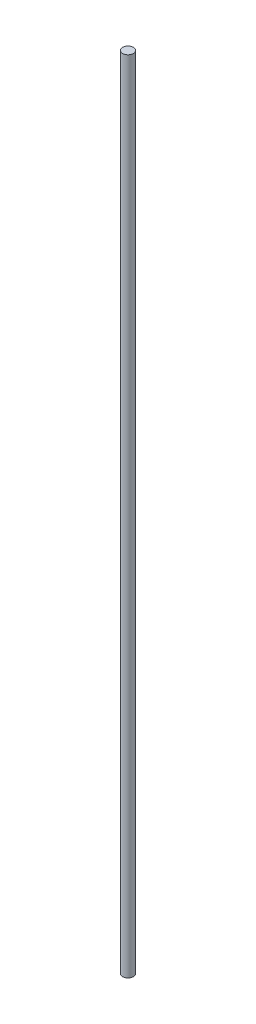
from build123d import *

# Parameters (mm, degrees)
ESQUISSE1_R        = 8.75
BOSS_EXTRU_1_DEPTH = 1300


with BuildPart() as part:
    # Esquisse1 → Boss.-Extru.1 (new body)
    with BuildSketch(Plane(origin=(0, 0, 0), x_dir=(1, 0, 0), z_dir=(0, 1, 0))):
        with Locations(Location((0, 0, 0), (0, 0, 270))):
            Circle(ESQUISSE1_R)
    extrude(amount=BOSS_EXTRU_1_DEPTH)


solid = part.part
